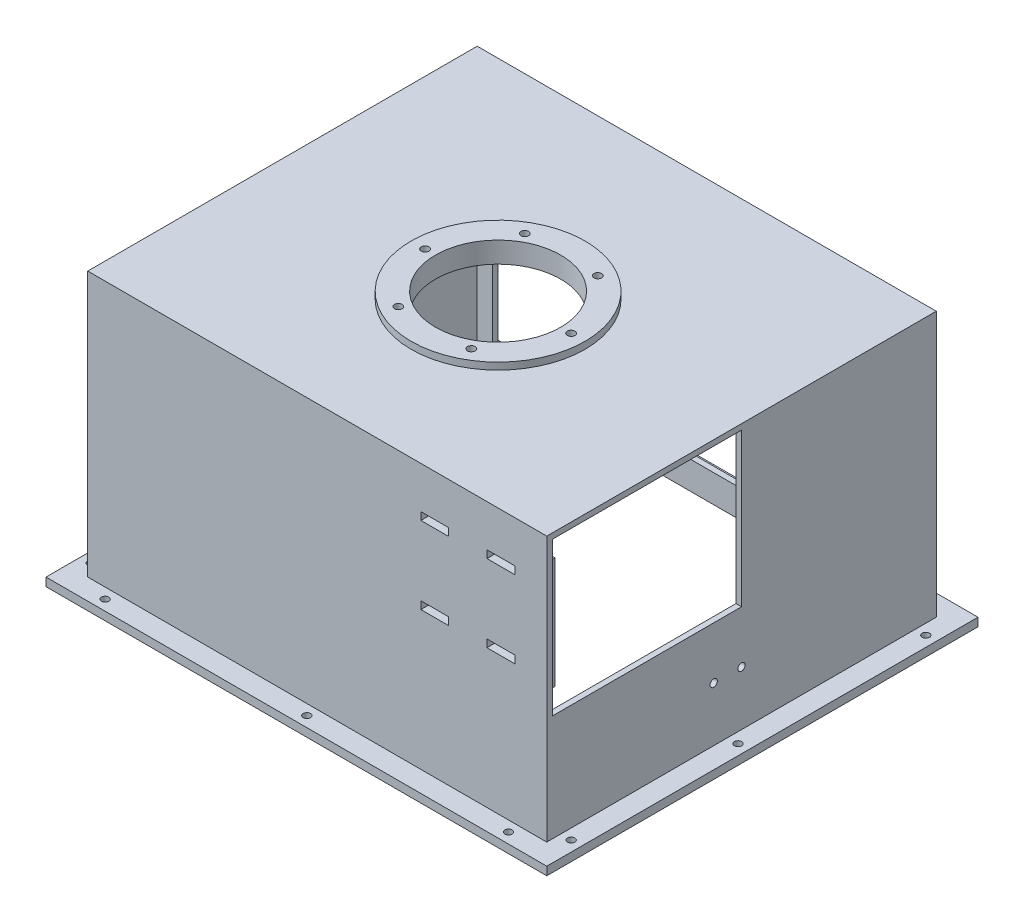
from build123d import *

# Parameters (mm, degrees)
SCHIZZO1_W                        = 720
SCHIZZO1_H                        = 620
ESTRUSIONE_ESTRUSIONE1_DEPTH      = 393
SCHIZZO3_W                        = 720
SCHIZZO3_H                        = 620
SCHIZZO3_W_2                      = 660
SCHIZZO3_H_2                      = 560
TAGLIO_ESTRUSIONE1_DEPTH          = 381
SCHIZZO4_R                        = 5.25
TAGLIO_ESTRUSIONE2_DEPTH          = 12
SCHIZZO5_W                        = 644
SCHIZZO5_H                        = 544
TAGLIO_ESTRUSIONE3_DEPTH          = 385
ESTRUSIONE_ESTRUSIONE2_DEPTH      = 10
ESTRUSIONE_ESTRUSIONE2_DEPTH_BACK = 20
SCHIZZO6_R                        = 125
SCHIZZO7_R                        = 90
TAGLIO_ESTRUSIONE4_DEPTH          = 30
FORO_PER_VITE_M10_1_D             = 11
RIPETIZIONECIRCOLARE1_COUNT       = 6
SCHIZZO14_W                       = 600
SCHIZZO14_H                       = 300
TAGLIO_ESTRUSIONE5_DEPTH          = 8
SCHIZZO16_R                       = 5.25
TAGLIO_ESTRUSIONE6_DEPTH          = 8
TAGLIO_ESTRUSIONE7_START          = -8
SCHIZZO17_R                       = 5.25
TAGLIO_ESTRUSIONE7_DEPTH          = 8
SCHIZZO18_W                       = 272
SCHIZZO18_H                       = 220
TAGLIO_ESTRUSIONE8_DEPTH          = 8
SCHIZZO19_W                       = 200
SCHIZZO19_H                       = 160
ESTRUSIONE_ESTRUSIONE3_DEPTH      = 12
SCHIZZO20_W                       = 40
SCHIZZO20_H                       = 11
TAGLIO_ESTRUSIONE9_DEPTH          = 20


with BuildPart() as part:
    # Schizzo1 → Estrusione-Estrusione1 (new body)
    with BuildSketch(Plane(origin=(0, 0, 0), x_dir=(1, 0, 0), z_dir=(0, 1, 0))):
        with Locations((360, 310)):
            Rectangle(SCHIZZO1_W, SCHIZZO1_H)
    extrude(amount=ESTRUSIONE_ESTRUSIONE1_DEPTH)

    # Schizzo3 → Taglio-Estrusione1 (cut)
    with BuildSketch(Plane(origin=(0, 393, 0), x_dir=(1, 0, 0), z_dir=(0, 1, 0))):
        with Locations((360, 310)):
            Rectangle(SCHIZZO3_W, SCHIZZO3_H)
        with Locations((360, 310)):
            Rectangle(SCHIZZO3_W_2, SCHIZZO3_H_2, mode=Mode.SUBTRACT)
    extrude(amount=-TAGLIO_ESTRUSIONE1_DEPTH, mode=Mode.SUBTRACT)

    # Schizzo4 → Taglio-Estrusione2 (cut)
    with BuildSketch(Plane(origin=(0, 12, 0), x_dir=(1, 0, 0), z_dir=(0, 1, 0))):
        with Locations(Location((360, 605, 0), (0, 0, 270))):
            Circle(SCHIZZO4_R)
        with Locations(Location((650, 605, 0), (0, 0, 270))):
            Circle(SCHIZZO4_R)
        with Locations(Location((70, 605, 0), (0, 0, 90))):
            Circle(SCHIZZO4_R)
        with Locations(Location((650, 15, 0), (0, 0, 90))):
            Circle(SCHIZZO4_R)
        with Locations(Location((360, 15, 0), (0, 0, 90))):
            Circle(SCHIZZO4_R)
        with Locations(Location((70, 15, 0), (0, 0, 270))):
            Circle(SCHIZZO4_R)
        with Locations(Location((705, 560, 0), (0, 0, 270))):
            Circle(SCHIZZO4_R)
        with Locations(Location((705, 290, 0), (0, 0, 270))):
            Circle(SCHIZZO4_R)
        with Locations(Location((705, 50, 0), (0, 0, 270))):
            Circle(SCHIZZO4_R)
        with Locations(Location((15, 50, 0), (0, 0, 90))):
            Circle(SCHIZZO4_R)
        with Locations(Location((15, 290, 0), (0, 0, 90))):
            Circle(SCHIZZO4_R)
        with Locations(Location((15, 560, 0), (0, 0, 90))):
            Circle(SCHIZZO4_R)
    extrude(amount=-TAGLIO_ESTRUSIONE2_DEPTH, mode=Mode.SUBTRACT)

    # Schizzo5 → Taglio-Estrusione3 (cut)
    with BuildSketch(Plane(origin=(0, 0, 0), x_dir=(1, 0, 0), z_dir=(0, 1, 0))):
        with Locations((360, 310)):
            Rectangle(SCHIZZO5_W, SCHIZZO5_H)
    extrude(amount=TAGLIO_ESTRUSIONE3_DEPTH, mode=Mode.SUBTRACT)

    # Schizzo6 → Estrusione-Estrusione2 (add, two sides: drawn at the far end of the back side and taken through both)
    with BuildSketch(Plane(origin=(0, 393, 0), x_dir=(1, 0, 0), z_dir=(0, 1, 0)).offset(-ESTRUSIONE_ESTRUSIONE2_DEPTH_BACK)):
        with Locations(Location((360, 290, 0), (0, 0, 270))):
            Circle(SCHIZZO6_R)
    extrude(amount=ESTRUSIONE_ESTRUSIONE2_DEPTH + ESTRUSIONE_ESTRUSIONE2_DEPTH_BACK)

    # Schizzo7 → Taglio-Estrusione4 (cut)
    with BuildSketch(Plane(origin=(0, 403, 0), x_dir=(1, 0, 0), z_dir=(0, 1, 0))):
        with Locations(Location((360, 290, 0), (0, 0, 270))):
            Circle(SCHIZZO7_R)
    extrude(amount=-TAGLIO_ESTRUSIONE4_DEPTH, mode=Mode.SUBTRACT)

    # Foro per Vite M10-1 (through all)
    with Locations(Plane(origin=(465, 403, -290), x_dir=(0, 0, 1), z_dir=(0, 1, 0))):
        with Locations((0, 0)):
            foro_per_vite_m10_1 = Hole(FORO_PER_VITE_M10_1_D / 2)

    # RipetizioneCircolare1: Foro per Vite M10-1 ×6 about axis
    ripetizionecircolare1_axis = Axis((360, 0, -290), (0, 1, 0))
    for i in range(1, RIPETIZIONECIRCOLARE1_COUNT):
        add(foro_per_vite_m10_1.rotate(ripetizionecircolare1_axis, i * 360 / RIPETIZIONECIRCOLARE1_COUNT), mode=Mode.SUBTRACT)

    # Schizzo14 → Taglio-Estrusione5 (cut)
    with BuildSketch(Plane.XY.offset(-582)):
        with Locations((360, 190)):
            Rectangle(SCHIZZO14_W, SCHIZZO14_H)
    extrude(amount=-TAGLIO_ESTRUSIONE5_DEPTH, mode=Mode.SUBTRACT)

    # Schizzo16 → Taglio-Estrusione6 (cut)
    with BuildSketch(Plane.ZY.offset(-30)):
        with Locations((-310, 90)):
            Circle(SCHIZZO16_R)
        with Locations((-270, 90)):
            Circle(SCHIZZO16_R)
    extrude(amount=-TAGLIO_ESTRUSIONE6_DEPTH, mode=Mode.SUBTRACT)

    # Schizzo17 → Taglio-Estrusione7 (cut)
    with BuildSketch(Plane(origin=(690, 0, 0), x_dir=(0, 0, -1), z_dir=(1, 0, 0)).offset(TAGLIO_ESTRUSIONE7_START)):
        with Locations(Location((310, 90, 0), (0, 0, 180))):
            Circle(SCHIZZO17_R)
        with Locations(Location((270, 90, 0), (0, 0, 180))):
            Circle(SCHIZZO17_R)
    extrude(amount=TAGLIO_ESTRUSIONE7_DEPTH, mode=Mode.SUBTRACT)

    # Schizzo18 → Taglio-Estrusione8 (cut)
    with BuildSketch(Plane.ZY.offset(-682)):
        with Locations((-174, 275)):
            Rectangle(SCHIZZO18_W, SCHIZZO18_H)
    extrude(amount=-TAGLIO_ESTRUSIONE8_DEPTH, mode=Mode.SUBTRACT)

    # Schizzo19 → Estrusione-Estrusione3 (add)
    with BuildSketch(Plane(origin=(0, 0, -38), x_dir=(-1, 0, 0), z_dir=(0, 0, -1))):
        with Locations((-582, 272)):
            Rectangle(SCHIZZO19_W, SCHIZZO19_H)
    extrude(amount=ESTRUSIONE_ESTRUSIONE3_DEPTH)

    # Schizzo20 → Taglio-Estrusione9 (cut)
    with BuildSketch(Plane(origin=(0, 0, -50), x_dir=(-1, 0, 0), z_dir=(0, 0, -1))):
        with Locations((-624, 216.5)):
            Rectangle(SCHIZZO20_W, SCHIZZO20_H)
        with Locations((-529, 216.5)):
            Rectangle(SCHIZZO20_W, SCHIZZO20_H)
        with Locations((-529, 327.5)):
            Rectangle(SCHIZZO20_W, SCHIZZO20_H)
        with Locations((-624, 327.5)):
            Rectangle(SCHIZZO20_W, SCHIZZO20_H)
    extrude(amount=-TAGLIO_ESTRUSIONE9_DEPTH, mode=Mode.SUBTRACT)


solid = part.part
